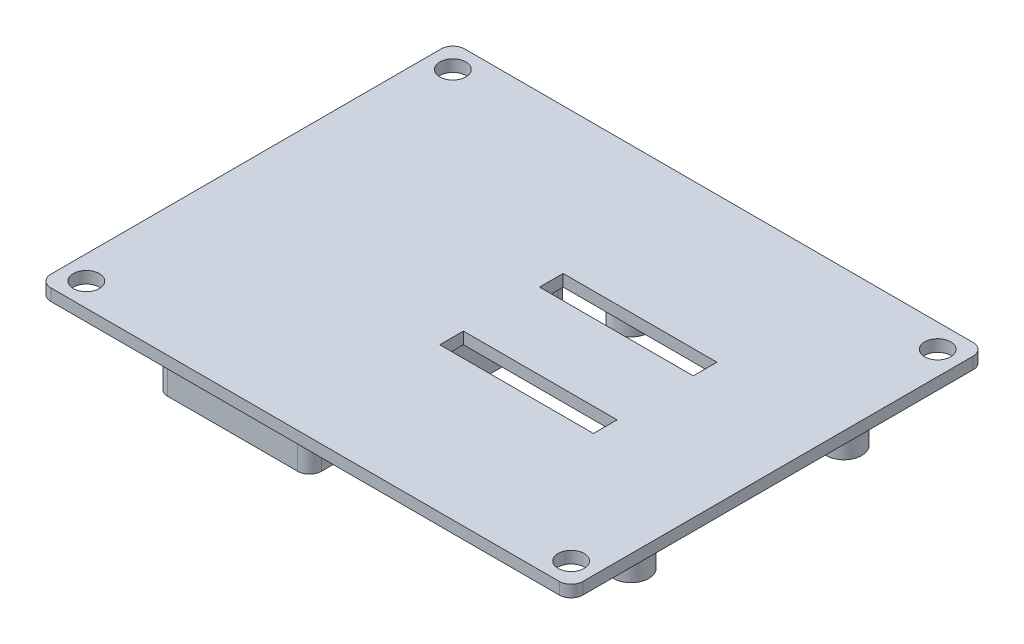
from build123d import *

# Parameters (mm, degrees)
SKETCH1_W                    = 114.3
SKETCH1_H                    = 88.9
BOSS_EXTRUDE2_DEPTH          = 2.54
SKETCH2_R                    = 2.794
CUT_EXTRUDE1_DEPTH           = 5.08
SKETCH9_W                    = 33.02
SKETCH9_H                    = 5.08
CUT_EXTRUDE5_DEPTH           = 6.35
SKETCH8_W                    = 33.02
SKETCH8_H                    = 55.88
BOSS_EXTRUDE4_DEPTH          = 21.59
SHELL4_T                     = -2.54
SKETCH13_W                   = 24.612851837
SKETCH13_H                   = 14.097856124
CUT_EXTRUDE6_DEPTH           = 5.08
FILLET5_R                    = 2.54
FILLET6_R                    = 2.54
FILLET7_R                    = 2.54
FILLET8_R                    = 2.54
FILLET1_R                    = 2.54
FILLET2_R                    = 2.54
FILLET3_R                    = 2.54
FILLET4_R                    = 2.54
SKETCH3_R                    = 3.81
BOSS_EXTRUDE5_DEPTH          = 8.89
SKETCH15_R                   = 1.651
CUT_EXTRUDE7_DEPTH           = 6.35
CUT_EXTRUDE7_DRAFT           = -2
CUT_EXTRUDE7_PROFILE_2_DEPTH = 6.35
CUT_EXTRUDE7_PROFILE_2_DRAFT = -2
CUT_EXTRUDE7_PROFILE_3_DEPTH = 6.35
CUT_EXTRUDE7_PROFILE_3_DRAFT = -2
CUT_EXTRUDE7_PROFILE_4_DEPTH = 6.35
CUT_EXTRUDE7_PROFILE_4_DRAFT = -2
FILLET9_R                    = 2.54
FILLET10_R                   = 2.54
FILLET11_R                   = 2.54
FILLET12_R                   = 2.54


with BuildPart() as part:
    # Sketch1 → Boss-Extrude2 (new body)
    with BuildSketch(Plane(origin=(0, 0, 0), x_dir=(1, 0, 0), z_dir=(0, 1, 0))):
        Rectangle(SKETCH1_W, SKETCH1_H)
    extrude(amount=BOSS_EXTRUDE2_DEPTH)

    # Sketch2 → Cut-Extrude1 (cut)
    with BuildSketch(Plane(origin=(0, 0, 0), x_dir=(-1, 0, 0), z_dir=(0, -1, 0))):
        with Locations(Location((52.07, 39.37, 0), (0, 0, 90))):
            Circle(SKETCH2_R)
        with Locations(Location((52.07, -39.37, 0), (0, 0, 90))):
            Circle(SKETCH2_R)
        with Locations(Location((-52.07, -39.37, 0), (0, 0, 90))):
            Circle(SKETCH2_R)
        with Locations(Location((-52.07, 39.37, 0), (0, 0, 90))):
            Circle(SKETCH2_R)
    extrude(amount=-CUT_EXTRUDE1_DEPTH, mode=Mode.SUBTRACT)

    # Sketch9 → Cut-Extrude5 (cut)
    with BuildSketch(Plane(origin=(0, 0, 0), x_dir=(-1, 0, 0), z_dir=(0, -1, 0))):
        with Locations((-14.245526461, -10.719909337)):
            Rectangle(SKETCH9_W, SKETCH9_H)
        with Locations((-14.245526461, 10.719909337)):
            Rectangle(SKETCH9_W, SKETCH9_H)
    extrude(amount=-CUT_EXTRUDE5_DEPTH, mode=Mode.SUBTRACT)

    # Fillet1
    fillet1_edges = [part.edges().sort_by_distance(p)[0] for p in [
        (57.15, 1.27, 44.45),
    ]]
    fillet(fillet1_edges, radius=FILLET1_R)

    # Fillet2
    fillet2_edges = [part.edges().sort_by_distance(p)[0] for p in [
        (-57.15, 1.27, -44.45),
    ]]
    fillet(fillet2_edges, radius=FILLET2_R)

    # Fillet3
    fillet3_edges = [part.edges().sort_by_distance(p)[0] for p in [
        (-57.15, 1.27, 44.45),
    ]]
    fillet(fillet3_edges, radius=FILLET3_R)

    # Fillet4
    fillet4_edges = [part.edges().sort_by_distance(p)[0] for p in [
        (57.15, 1.27, -44.45),
    ]]
    fillet(fillet4_edges, radius=FILLET4_R)

    # Sketch3 → Boss-Extrude5 (add)
    with BuildSketch(Plane(origin=(0, 0, 0), x_dir=(-1, 0, 0), z_dir=(0, -1, 0))):
        with Locations(Location((-2.726054499, -22.86, 0), (0, 0, 90))):
            Circle(SKETCH3_R)
        with Locations(Location((-48.446054499, -22.86, 0), (0, 0, 90))):
            Circle(SKETCH3_R)
        with Locations(Location((-48.446054499, 22.86, 0), (0, 0, 90))):
            Circle(SKETCH3_R)
        with Locations(Location((-2.726054499, 22.86, 0), (0, 0, 90))):
            Circle(SKETCH3_R)
    extrude(amount=BOSS_EXTRUDE5_DEPTH)


with BuildPart() as body_2:
    # Sketch8 → Boss-Extrude4 (new body)
    with BuildSketch(Plane(origin=(0, 0, 0), x_dir=(-1, 0, 0), z_dir=(0, -1, 0))):
        with Locations((32.055940653, 0)):
            Rectangle(SKETCH8_W, SKETCH8_H)
    extrude(amount=BOSS_EXTRUDE4_DEPTH)

    # Shell4
    shell4_openings = [body_2.faces().sort_by_distance(p)[0] for p in [
        (-32.055940653, -21.59, 0),
    ]]
    offset(amount=SHELL4_T, openings=shell4_openings, kind=Kind.INTERSECTION)

    # Sketch13 → Cut-Extrude6 (cut)
    with BuildSketch(Plane(origin=(0, 0, -27.94), x_dir=(-1, 0, 0), z_dir=(0, 0, -1))):
        with Locations((32.055940652, -10.795)):
            Rectangle(SKETCH13_W, SKETCH13_H)
    extrude(amount=-CUT_EXTRUDE6_DEPTH, mode=Mode.SUBTRACT)

    # Fillet5
    fillet5_edges = [body_2.edges().sort_by_distance(p)[0] for p in [
        (-19.749514734, -17.843928062, -26.67),
    ]]
    fillet(fillet5_edges, radius=FILLET5_R)

    # Fillet6
    fillet6_edges = [body_2.edges().sort_by_distance(p)[0] for p in [
        (-19.749514734, -3.746071938, -26.67),
    ]]
    fillet(fillet6_edges, radius=FILLET6_R)

    # Fillet7
    fillet7_edges = [body_2.edges().sort_by_distance(p)[0] for p in [
        (-44.362366571, -3.746071938, -26.67),
    ]]
    fillet(fillet7_edges, radius=FILLET7_R)

    # Fillet8
    fillet8_edges = [body_2.edges().sort_by_distance(p)[0] for p in [
        (-44.362366571, -17.843928062, -26.67),
    ]]
    fillet(fillet8_edges, radius=FILLET8_R)

    # Fillet9
    fillet9_edges = [body_2.edges().sort_by_distance(p)[0] for p in [
        (-15.545940653, -10.795, -27.94),
    ]]
    fillet(fillet9_edges, radius=FILLET9_R)

    # Fillet10
    fillet10_edges = [body_2.edges().sort_by_distance(p)[0] for p in [
        (-15.545940653, -10.795, 27.94),
    ]]
    fillet(fillet10_edges, radius=FILLET10_R)

    # Fillet11
    fillet11_edges = [body_2.edges().sort_by_distance(p)[0] for p in [
        (-48.565940653, -10.795, 27.94),
    ]]
    fillet(fillet11_edges, radius=FILLET11_R)

    # Fillet12
    fillet12_edges = [body_2.edges().sort_by_distance(p)[0] for p in [
        (-48.565940653, -10.795, -27.94),
    ]]
    fillet(fillet12_edges, radius=FILLET12_R)


with BuildPart() as cut_extrude7_tool:
    # Sketch15 → Cut-Extrude7 (with draft: the straight prism first)
    with BuildSketch(Plane(origin=(0, -8.89, 0), x_dir=(-1, 0, 0), z_dir=(0, -1, 0))):
        with Locations((-48.446054499, -22.86)):
            Circle(SKETCH15_R)
    extrude(amount=-CUT_EXTRUDE7_DEPTH)
    # Cut-Extrude7: the draft: its side faces are tilted about the plane it starts from
    cut_extrude7_sides = [cut_extrude7_tool.faces().sort_by_distance(p)[0] for p in [
        (50.097054499, -5.715, 22.86),
    ]]
    draft(cut_extrude7_sides, Plane(origin=(0, -8.89, 0), x_dir=(-1, 0, 0), z_dir=(0, -1, 0)), CUT_EXTRUDE7_DRAFT)


with BuildPart() as part_1:
    add(part.part)

    # Cut-Extrude7: cut by cut_extrude7_tool
    add(cut_extrude7_tool.part, mode=Mode.SUBTRACT)


with BuildPart() as cut_extrude7_profile_2_tool:
    # Sketch15 → Cut-Extrude7 profile 2 (with draft: the straight prism first)
    with BuildSketch(Plane(origin=(0, -8.89, 0), x_dir=(-1, 0, 0), z_dir=(0, -1, 0))):
        with Locations((-2.726054499, -22.86)):
            Circle(SKETCH15_R)
    extrude(amount=-CUT_EXTRUDE7_PROFILE_2_DEPTH)
    # Cut-Extrude7 profile 2: the draft: its side faces are tilted about the plane it starts from
    cut_extrude7_profile_2_sides = [cut_extrude7_profile_2_tool.faces().sort_by_distance(p)[0] for p in [
        (4.377054499, -5.715, 22.86),
    ]]
    draft(cut_extrude7_profile_2_sides, Plane(origin=(0, -8.89, 0), x_dir=(-1, 0, 0), z_dir=(0, -1, 0)), CUT_EXTRUDE7_PROFILE_2_DRAFT)


with BuildPart() as part_2:
    add(part_1.part)

    # Cut-Extrude7 profile 2: cut by cut_extrude7_profile_2_tool
    add(cut_extrude7_profile_2_tool.part, mode=Mode.SUBTRACT)


with BuildPart() as cut_extrude7_profile_3_tool:
    # Sketch15 → Cut-Extrude7 profile 3 (with draft: the straight prism first)
    with BuildSketch(Plane(origin=(0, -8.89, 0), x_dir=(-1, 0, 0), z_dir=(0, -1, 0))):
        with Locations((-2.726054499, 22.86)):
            Circle(SKETCH15_R)
    extrude(amount=-CUT_EXTRUDE7_PROFILE_3_DEPTH)
    # Cut-Extrude7 profile 3: the draft: its side faces are tilted about the plane it starts from
    cut_extrude7_profile_3_sides = [cut_extrude7_profile_3_tool.faces().sort_by_distance(p)[0] for p in [
        (4.377054499, -5.715, -22.86),
    ]]
    draft(cut_extrude7_profile_3_sides, Plane(origin=(0, -8.89, 0), x_dir=(-1, 0, 0), z_dir=(0, -1, 0)), CUT_EXTRUDE7_PROFILE_3_DRAFT)


with BuildPart() as part_3:
    add(part_2.part)

    # Cut-Extrude7 profile 3: cut by cut_extrude7_profile_3_tool
    add(cut_extrude7_profile_3_tool.part, mode=Mode.SUBTRACT)


with BuildPart() as cut_extrude7_profile_4_tool:
    # Sketch15 → Cut-Extrude7 profile 4 (with draft: the straight prism first)
    with BuildSketch(Plane(origin=(0, -8.89, 0), x_dir=(-1, 0, 0), z_dir=(0, -1, 0))):
        with Locations((-48.446054499, 22.86)):
            Circle(SKETCH15_R)
    extrude(amount=-CUT_EXTRUDE7_PROFILE_4_DEPTH)
    # Cut-Extrude7 profile 4: the draft: its side faces are tilted about the plane it starts from
    cut_extrude7_profile_4_sides = [cut_extrude7_profile_4_tool.faces().sort_by_distance(p)[0] for p in [
        (50.097054499, -5.715, -22.86),
    ]]
    draft(cut_extrude7_profile_4_sides, Plane(origin=(0, -8.89, 0), x_dir=(-1, 0, 0), z_dir=(0, -1, 0)), CUT_EXTRUDE7_PROFILE_4_DRAFT)


with BuildPart() as part_4:
    add(part_3.part)

    # Cut-Extrude7 profile 4: cut by cut_extrude7_profile_4_tool
    add(cut_extrude7_profile_4_tool.part, mode=Mode.SUBTRACT)


solid = Compound([body_2.part, part_4.part])
